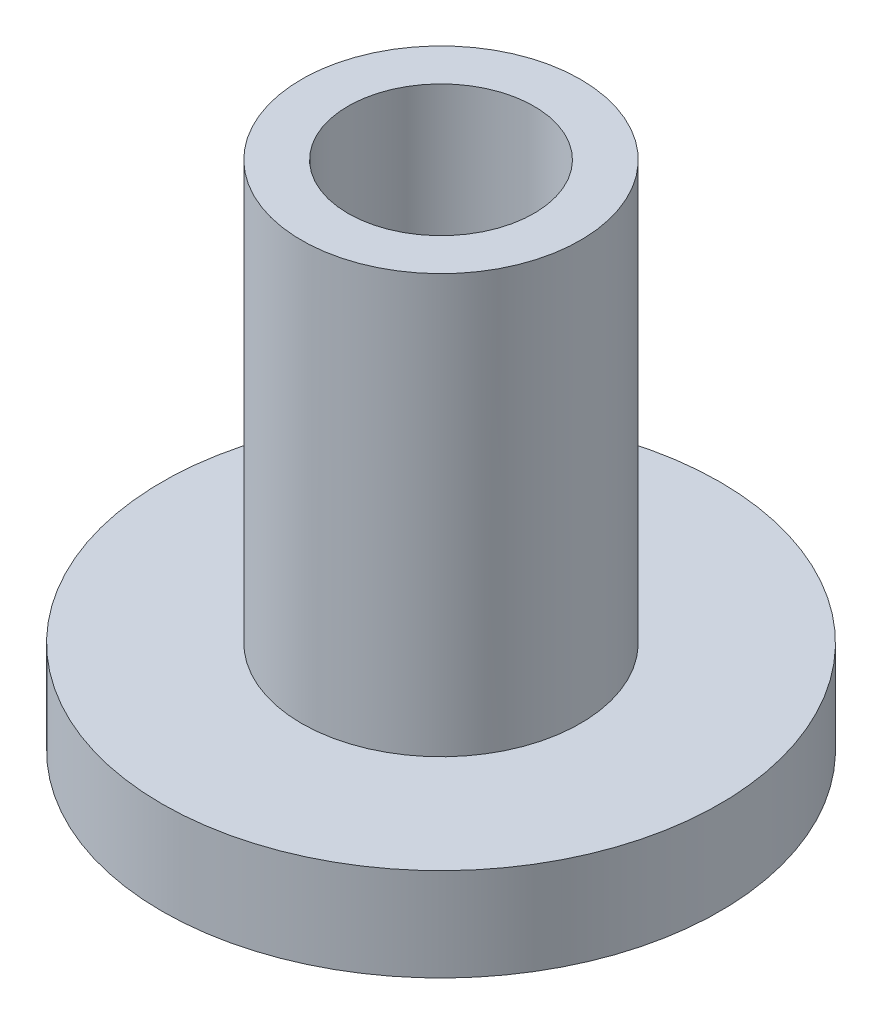
from build123d import *

# Parameters (mm, degrees)
SKETCH1_R           = 38.1
SKETCH1_R_2         = 19.05
BOSS_EXTRUDE1_DEPTH = 12.7
SKETCH2_R           = 19.05
BOSS_EXTRUDE3_DEPTH = 69.85
SKETCH3_R           = 12.7
CUT_EXTRUDE1_DEPTH  = 69.85


with BuildPart() as part:
    # Sketch1 → Boss-Extrude1 (new body)
    with BuildSketch(Plane(origin=(0, 0, 0), x_dir=(1, 0, 0), z_dir=(0, 1, 0))):
        with Locations(Location((0, 0, 0), (0, 0, 270))):
            Circle(SKETCH1_R)
        with Locations(Location((0, 0, 0), (0, 0, 270))):
            Circle(SKETCH1_R_2, mode=Mode.SUBTRACT)
    extrude(amount=BOSS_EXTRUDE1_DEPTH)

    # Sketch2 → Boss-Extrude3 (add)
    with BuildSketch(Plane.XZ):
        with Locations(Location((0, 0, 0), (0, 0, 270))):
            Circle(SKETCH2_R)
    extrude(amount=-BOSS_EXTRUDE3_DEPTH)

    # Sketch3 → Cut-Extrude1 (cut)
    with BuildSketch(Plane(origin=(0, 69.85, 0), x_dir=(1, 0, 0), z_dir=(0, 1, 0))):
        with Locations(Location((0, 0, 0), (0, 0, 270))):
            Circle(SKETCH3_R)
    extrude(amount=-CUT_EXTRUDE1_DEPTH, mode=Mode.SUBTRACT)


solid = part.part
